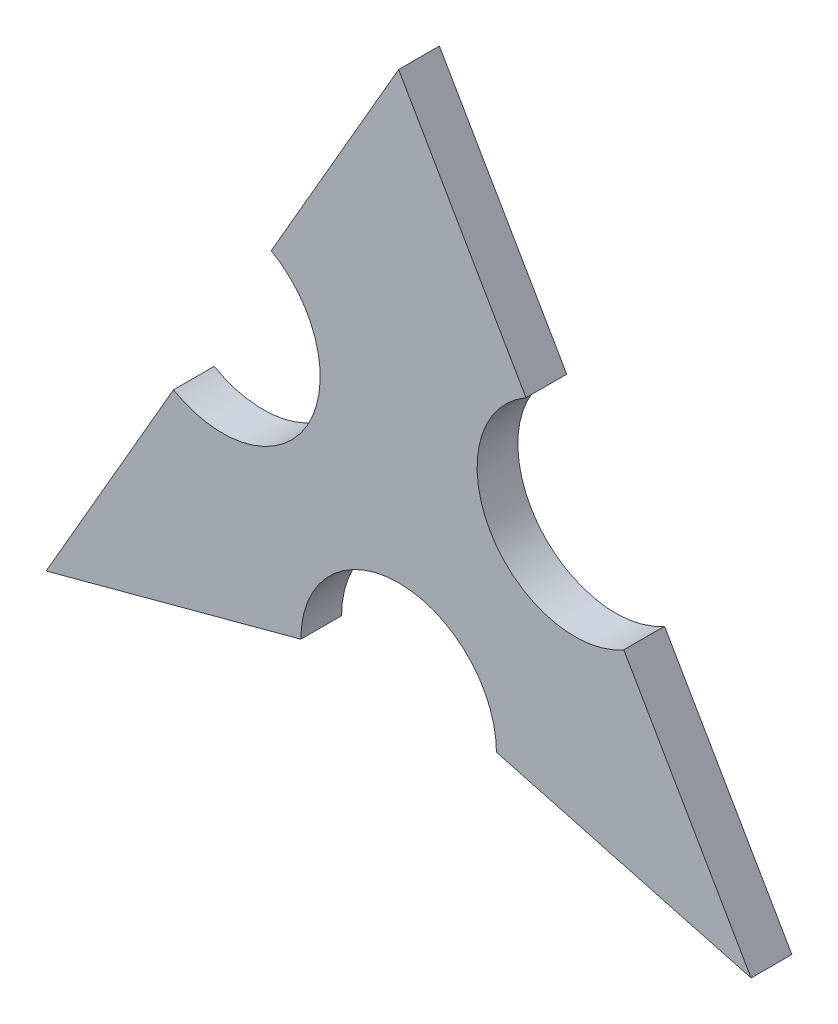
from build123d import *

# Parameters (mm, degrees)
BOSS_EXTRUDE1_DEPTH = 5


with BuildPart() as part:
    # Sketch1 → Boss-Extrude1 (new, symmetric)
    with BuildSketch(Plane.XY):
        with BuildLine():
            Line((0, 149.822394855), (-31.25, 95.695807118))
            ThreePointArc((-31.25, 95.695807118), (-22.465390309, 62.911197427), (-55.25, 54.126587737))
            Line((-55.25, 54.126587737), (-86.5, 0))
            Line((-86.5, 0), (-24, 16.746824527))
            ThreePointArc((-24, 16.746824527), (0, 40.746824527), (24, 16.746824527))
            Line((24, 16.746824527), (86.5, 0))
            Line((86.5, 0), (55.25, 54.126587737))
            ThreePointArc((55.25, 54.126587737), (22.465390309, 62.911197427), (31.25, 95.695807118))
            Line((31.25, 95.695807118), (0, 149.822394855))
        make_face()
    extrude(amount=BOSS_EXTRUDE1_DEPTH, both=True)


solid = part.part
